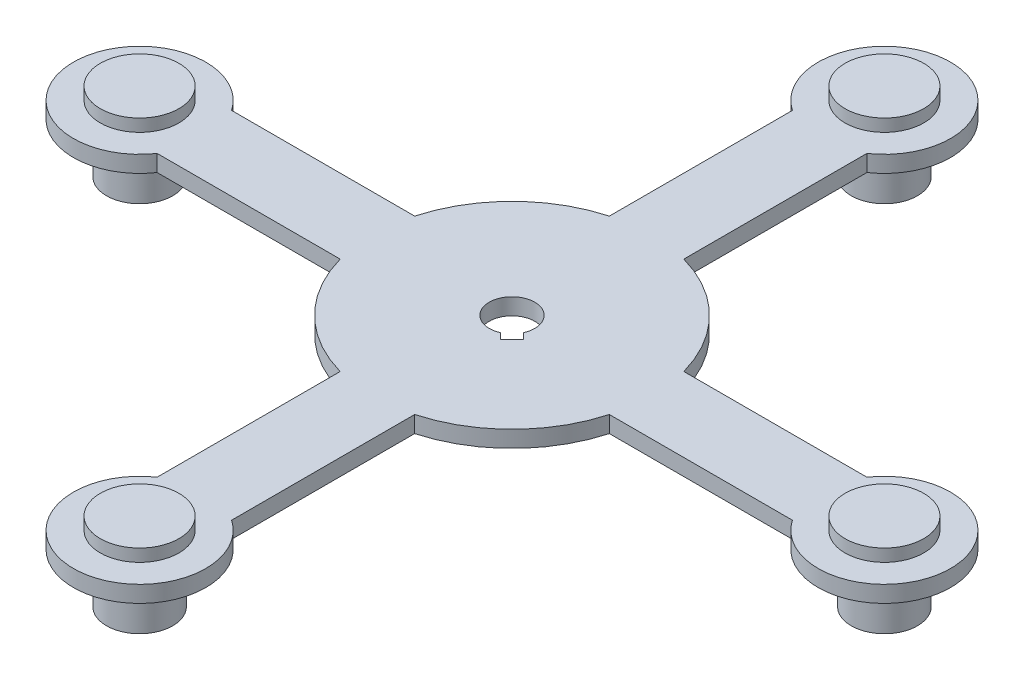
from build123d import *

# Parameters (mm, degrees)
SKETCH1_R           = 32
SKETCH1_R_2         = 67.5
SKETCH1_W           = 36
SKETCH1_H           = 360
SKETCH1_W_2         = 360
SKETCH1_H_2         = 36
BOSS_EXTRUDE1_DEPTH = 4
SKETCH2_R           = 16
BOSS_EXTRUDE2_DEPTH = 24
SKETCH3_R           = 19
BOSS_EXTRUDE3_DEPTH = 6
CUT_EXTRUDE1_DEPTH  = 8


with BuildPart() as part:
    # Sketch1 → Boss-Extrude1 (new, symmetric)
    with BuildSketch(Plane(origin=(0, 0, 0), x_dir=(1, 0, 0), z_dir=(0, 1, 0))):
        with Locations((0, 180)):
            Circle(SKETCH1_R)
        with Locations((180, 0)):
            Circle(SKETCH1_R)
        with Locations((0, -180)):
            Circle(SKETCH1_R)
        with Locations((-180, 0)):
            Circle(SKETCH1_R)
        Circle(SKETCH1_R_2)
        Rectangle(SKETCH1_W, SKETCH1_H)
        Rectangle(SKETCH1_W_2, SKETCH1_H_2)
    extrude(amount=BOSS_EXTRUDE1_DEPTH, both=True)

    # Sketch2 → Boss-Extrude2 (add)
    with BuildSketch(Plane(origin=(0, -4, 0), x_dir=(1, 0, 0), z_dir=(0, 1, 0))):
        with Locations(Location((-180, 0, 0), (0, 0, 270))):
            Circle(SKETCH2_R)
        with Locations(Location((0, -180, 0), (0, 0, 270))):
            Circle(SKETCH2_R)
        with Locations(Location((180, 0, 0), (0, 0, 270))):
            Circle(SKETCH2_R)
        with Locations(Location((0, 180, 0), (0, 0, 270))):
            Circle(SKETCH2_R)
    extrude(amount=-BOSS_EXTRUDE2_DEPTH)

    # Sketch3 → Boss-Extrude3 (add)
    with BuildSketch(Plane(origin=(0, 4, 0), x_dir=(1, 0, 0), z_dir=(0, 1, 0))):
        with Locations(Location((-180, 0, 0), (0, 0, 270))):
            Circle(SKETCH3_R)
        with Locations(Location((0, 180, 0), (0, 0, 270))):
            Circle(SKETCH3_R)
        with Locations(Location((180, 0, 0), (0, 0, 270))):
            Circle(SKETCH3_R)
        with Locations(Location((0, -180, 0), (0, 0, 270))):
            Circle(SKETCH3_R)
    extrude(amount=BOSS_EXTRUDE3_DEPTH)

    # Sketch4 → Cut-Extrude1 (cut)
    with BuildSketch(Plane(origin=(0, 4, 0), x_dir=(1, 0, 0), z_dir=(0, 1, 0))):
        with BuildLine():
            ThreePointArc((11, 0), (-9.208416632, 6.017064329), (4.417261248, -10.074115498))
            Line((4.417261248, -10.074115498), (10.074115498, -4.417261248))
            ThreePointArc((10.074115498, -4.417261248), (10.766040834, -2.256626855), (11, 0))
        make_face()
        with BuildLine():
            Line((10.074115498, -4.417261248), (4.417261248, -10.074115498))
            ThreePointArc((4.417261248, -10.074115498), (7.778174593, -7.778174593), (10.074115498, -4.417261248))
        make_face()
        with BuildLine():
            ThreePointArc((10.074115498, -4.417261248), (7.778174593, -7.778174593), (4.417261248, -10.074115498))
            Line((4.417261248, -10.074115498), (7.283199846, -12.940054096))
            Line((7.283199846, -12.940054096), (12.940054096, -7.283199846))
            Line((12.940054096, -7.283199846), (10.074115498, -4.417261248))
        make_face()
    extrude(amount=-CUT_EXTRUDE1_DEPTH, mode=Mode.SUBTRACT)


solid = part.part
